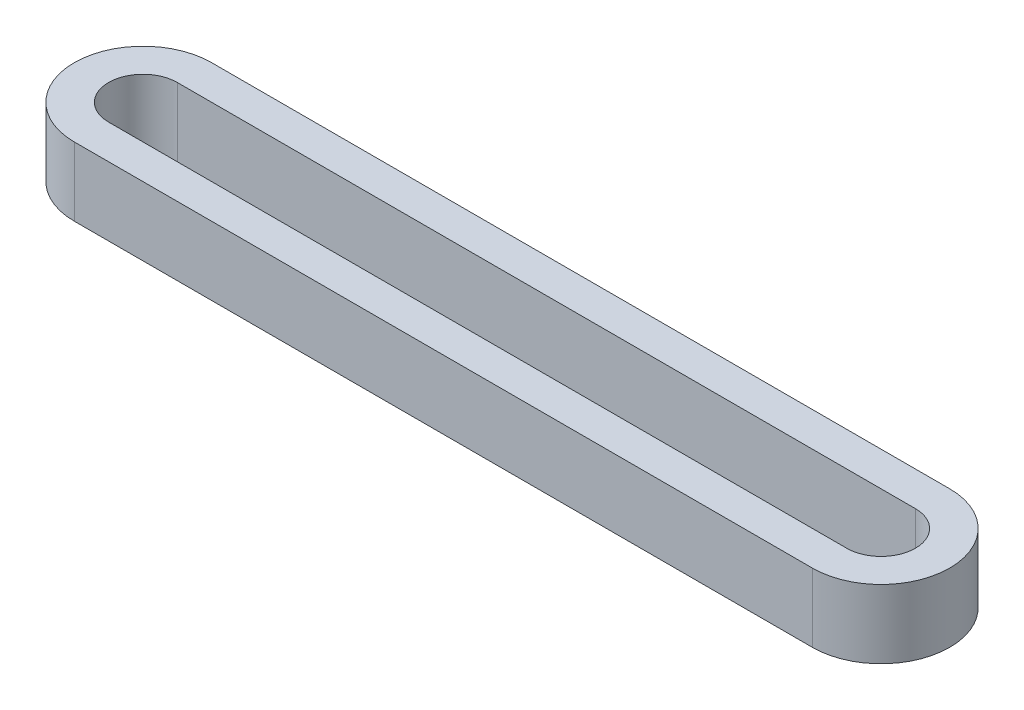
from build123d import *

# Parameters (mm, degrees)
EXTRUDE_1_DEPTH = 2


with BuildPart() as part:
    # 草图1 → 凸台-拉伸1 (new body)
    with BuildSketch(Plane(origin=(0, 0, 0), x_dir=(1, 0, 0), z_dir=(0, 1, 0))):
        with BuildLine():
            Line((-10.75, 2), (10.75, 2))
            ThreePointArc((10.75, 2), (12.75, 0), (10.75, -2))
            Line((10.75, -2), (-10.75, -2))
            ThreePointArc((-10.75, -2), (-12.75, 0), (-10.75, 2))
        make_face()
        with BuildLine():
            Line((-10.75, 1), (10.75, 1))
            ThreePointArc((10.75, 1), (11.75, 0), (10.75, -1))
            Line((10.75, -1), (-10.75, -1))
            ThreePointArc((-10.75, -1), (-11.75, 0), (-10.75, 1))
        make_face(mode=Mode.SUBTRACT)
    extrude(amount=EXTRUDE_1_DEPTH)


solid = part.part
